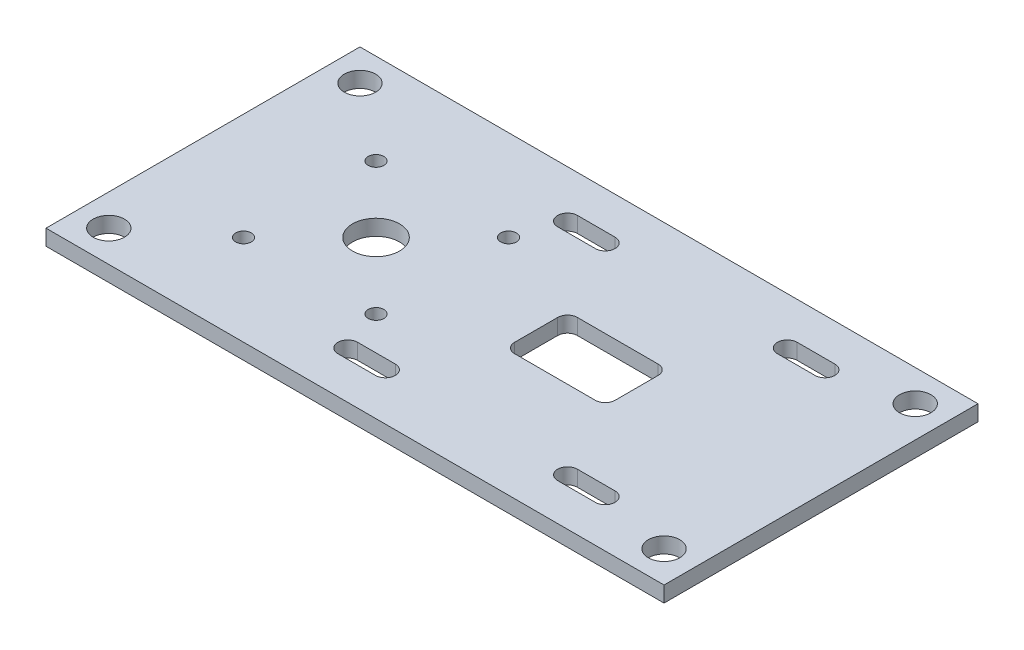
from build123d import *

# Parameters (mm, degrees)
SKETCH1_W           = 250
SKETCH1_H           = 127
BOSS_EXTRUDE1_DEPTH = 6.35
SKETCH2_R           = 6.35
SKETCH2_R_2         = 3.175
SKETCH2_R_3         = 9.525
SKETCH2_R_4         = 4
SKETCH2_R_5         = 12.5
CUT_EXTRUDE1_DEPTH  = 281.480520714
CUT_EXTRUDE2_DEPTH  = 281.480520714
SKETCH9_W           = 40.64
SKETCH9_H           = 25.4
CUT_EXTRUDE3_DEPTH  = 281.480520714
FILLET1_R           = 3.96875


with BuildPart() as part:
    # Sketch1 → Boss-Extrude1 (new body)
    with BuildSketch(Plane(origin=(0, 0, 0), x_dir=(1, 0, 0), z_dir=(0, 1, 0))):
        with Locations((125, 63.5)):
            Rectangle(SKETCH1_W, SKETCH1_H)
    extrude(amount=BOSS_EXTRUDE1_DEPTH)

    # Sketch2 → Cut-Extrude1 (cut, through all)
    with BuildSketch(Plane(origin=(0, 6.35, 0), x_dir=(1, 0, 0), z_dir=(0, 1, 0))):
        with Locations(Location((237.3, 12.7, 0), (0, 0, 270))):
            Circle(SKETCH2_R)
        with Locations(Location((237.3, 114.3, 0), (0, 0, 270))):
            Circle(SKETCH2_R)
        with Locations(Location((12.7, 12.7, 0), (0, 0, 270))):
            Circle(SKETCH2_R)
        with Locations(Location((12.7, 114.3, 0), (0, 0, 270))):
            Circle(SKETCH2_R)
        with Locations(Location((43.193581925, 36.693581925, 0), (0, 0, 270))):
            Circle(SKETCH2_R_2)
        with Locations(Location((96.806418075, 36.693581925, 0), (0, 0, 270))):
            Circle(SKETCH2_R_2)
        with Locations(Location((96.806418075, 90.306418075, 0), (0, 0, 270))):
            Circle(SKETCH2_R_2)
        with Locations(Location((43.193581925, 90.306418075, 0), (0, 0, 270))):
            Circle(SKETCH2_R_2)
        with Locations(Location((70, 63.5, 0), (0, 0, 270))):
            Circle(SKETCH2_R_3)
        with Locations(Location((105.55, 19.05, 0), (0, 0, 270))):
            Circle(SKETCH2_R_4)
        with Locations(Location((194.45, 19.05, 0), (0, 0, 270))):
            Circle(SKETCH2_R_4)
        with Locations(Location((194.45, 107.95, 0), (0, 0, 270))):
            Circle(SKETCH2_R_4)
        with Locations(Location((105.55, 107.95, 0), (0, 0, 270))):
            Circle(SKETCH2_R_4)
        with Locations(Location((150, 63.5, 0), (0, 0, 270))):
            Circle(SKETCH2_R_5)
    extrude(amount=-CUT_EXTRUDE1_DEPTH, mode=Mode.SUBTRACT)

    # Sketch8 → Cut-Extrude2 (cut, through all)
    with BuildSketch(Plane(origin=(0, 6.35, 0), x_dir=(1, 0, 0), z_dir=(0, 1, 0))):
        with BuildLine():
            Line((103.01, 111.95), (118.25, 111.95))
            ThreePointArc((118.25, 111.95), (122.25, 107.95), (118.25, 103.95))
            Line((118.25, 103.95), (103.01, 103.95))
            ThreePointArc((103.01, 103.95), (99.01, 107.95), (103.01, 111.95))
        make_face()
        with BuildLine():
            Line((191.91, 111.95), (207.15, 111.95))
            ThreePointArc((207.15, 111.95), (211.15, 107.95), (207.15, 103.95))
            Line((207.15, 103.95), (191.91, 103.95))
            ThreePointArc((191.91, 103.95), (187.91, 107.95), (191.91, 111.95))
        make_face()
        with BuildLine():
            Line((103.01, 23.05), (118.25, 23.05))
            ThreePointArc((118.25, 23.05), (122.25, 19.05), (118.25, 15.05))
            Line((118.25, 15.05), (103.01, 15.05))
            ThreePointArc((103.01, 15.05), (99.01, 19.05), (103.01, 23.05))
        make_face()
        with BuildLine():
            Line((191.91, 23.05), (207.15, 23.05))
            ThreePointArc((207.15, 23.05), (211.15, 19.05), (207.15, 15.05))
            Line((207.15, 15.05), (191.91, 15.05))
            ThreePointArc((191.91, 15.05), (187.91, 19.05), (191.91, 23.05))
        make_face()
    extrude(amount=-CUT_EXTRUDE2_DEPTH, mode=Mode.SUBTRACT)

    # Sketch9 → Cut-Extrude3 (cut, through all)
    with BuildSketch(Plane(origin=(0, 6.35, 0), x_dir=(1, 0, 0), z_dir=(0, 1, 0))):
        with Locations((155.08, 63.5)):
            Rectangle(SKETCH9_W, SKETCH9_H)
    extrude(amount=-CUT_EXTRUDE3_DEPTH, mode=Mode.SUBTRACT)

    # Fillet1
    fillet1_edges = [part.edges().sort_by_distance(p)[0] for p in [
        (134.76, 3.175, -50.8),
        (134.76, 3.175, -76.2),
        (175.4, 3.175, -76.2),
        (175.4, 3.175, -50.8),
    ]]
    fillet(fillet1_edges, radius=FILLET1_R)


solid = part.part
